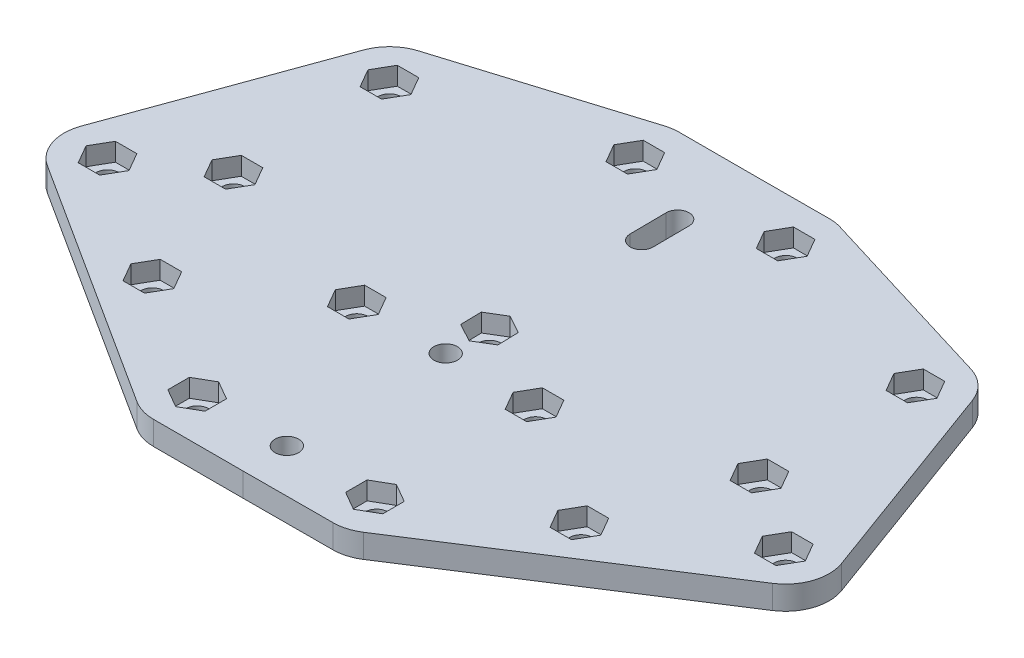
from build123d import *

# Parameters (mm, degrees)
SKETCH2_R          = 3.15
SKETCH2_R_2        = 3.25
SKETCH2_R_3        = 3.1
MAINPLATE_DEPTH    = 6.5
PRESSFITNUTS_DEPTH = 5


with BuildPart() as part:
    # Sketch2 → MainPlate (new body)
    with BuildSketch(Plane(origin=(0, 0, 0), x_dir=(1, 0, 0), z_dir=(0, 1, 0))):
        with BuildLine():
            Line((24.899900609, -92.429929219), (0.2, -92.5))
            Line((0.2, -92.5), (-24.5, -92.5))
            ThreePointArc((-24.5, -92.5), (-27.871368271, -92.016678166), (-30.971160559, -90.605645997))
            Line((-30.971160559, -90.605645997), (-99.683475736, -46.605645997))
            ThreePointArc((-99.683475736, -46.605645997), (-104.578950448, -40.347025165), (-104.490786491, -32.401697323))
            Line((-104.490786491, -32.401697323), (-83.778471314, 24.598302677))
            ThreePointArc((-83.778471314, 24.598302677), (-80.773721892, 29.191692934), (-76.037940173, 31.966602781))
            Line((-76.037940173, 31.966602781), (-24.911380811, 47.741345462))
            ThreePointArc((-24.911380811, 47.741345462), (-22.845839779, 48.308813352), (-20.712315177, 48.5))
            Line((-20.712315177, 48.5), (0, 48.5))
            Line((0, 48.5), (20.712231832, 48.558758223))
            ThreePointArc((20.712231832, 48.558758223), (22.846290221, 48.373624884), (24.913432777, 47.812018957))
            Line((24.913432777, 47.812018957), (76.084537362, 32.182379345))
            ThreePointArc((76.084537362, 32.182379345), (80.828172093, 29.420915478), (83.845940292, 24.836067799))
            Line((83.845940292, 24.836067799), (104.719873926, -32.104944614))
            ThreePointArc((104.719873926, -32.104944614), (104.830577421, -40.049990373), (99.952877324, -46.322473865))
            Line((99.952877324, -46.322473865), (31.365661085, -90.517224974))
            ThreePointArc((31.365661085, -90.517224974), (28.26988419, -91.937045184), (24.899900609, -92.429929219))
        make_face()
        with Locations(Location((-72.5, 20.5, 0), (0, 0, 90))):
            Circle(SKETCH2_R, mode=Mode.SUBTRACT)
        with Locations(Location((-20.712315177, 36.5, 0), (0, 0, 90))):
            Circle(SKETCH2_R, mode=Mode.SUBTRACT)
        with Locations(Location((-93.212315177, -36.5, 0), (0, 0, 90))):
            Circle(SKETCH2_R, mode=Mode.SUBTRACT)
        with Locations(Location((-58.856157589, -58.5, 0), (0, 0, 90))):
            Circle(SKETCH2_R, mode=Mode.SUBTRACT)
        with Locations(Location((-24.5, -80.5, 0), (0, 0, 90))):
            Circle(SKETCH2_R, mode=Mode.SUBTRACT)
        with Locations(Location((-24.5, -36.5, 0), (0, 0, 90))):
            Circle(SKETCH2_R, mode=Mode.SUBTRACT)
        with Locations(Location((-72.5, -22.5, 0), (0, 0, 90))):
            Circle(SKETCH2_R, mode=Mode.SUBTRACT)
        with Locations(Location((24.74103568, -36.430154559, 0), (0, 0, 90))):
            Circle(SKETCH2_R, mode=Mode.SUBTRACT)
        with Locations(Location((24.865858124, -80.429977506, 0), (0, 0, 90))):
            Circle(SKETCH2_R, mode=Mode.SUBTRACT)
        with Locations(Location((59.159466244, -58.332601952, 0), (0, 0, 90))):
            Circle(SKETCH2_R, mode=Mode.SUBTRACT)
        with Locations(Location((93.453074364, -36.235226398, 0), (0, 0, 90))):
            Circle(SKETCH2_R, mode=Mode.SUBTRACT)
        with Locations(Location((72.701126299, -22.294040956, 0), (0, 0, 90))):
            Circle(SKETCH2_R, mode=Mode.SUBTRACT)
        with Locations(Location((72.579140729, 20.705786015, 0), (0, 0, 90))):
            Circle(SKETCH2_R, mode=Mode.SUBTRACT)
        with Locations(Location((20.746274317, 36.55880651, 0), (0, 0, 90))):
            Circle(SKETCH2_R, mode=Mode.SUBTRACT)
        with Locations(Location((0, -36.5, 0), (0, 0, 90))):
            Circle(SKETCH2_R_2, mode=Mode.SUBTRACT)
        with Locations(Location((0.182929062, -80.464988753, 0), (0, 0, 90))):
            Circle(SKETCH2_R_2, mode=Mode.SUBTRACT)
        with Locations(Location((0.103546099, -24.5, 0), (0, 0, 90))):
            Circle(SKETCH2_R_3, mode=Mode.SUBTRACT)
        with BuildLine():
            Line((3.105906565, 27.527701056), (3.193849827, 17.527701056))
            ThreePointArc((3.193849827, 17.527701056), (0.071672688, 14.350121804), (-3.105906565, 17.472298944))
            Line((-3.105906565, 17.472298944), (-3.193849827, 27.472298944))
            ThreePointArc((-3.193849827, 27.472298944), (-0.071672688, 30.649878196), (3.105906565, 27.527701056))
        make_face(mode=Mode.SUBTRACT)
    extrude(amount=MAINPLATE_DEPTH)

    # Sketch8 → PressFitNuts (cut)
    with BuildSketch(Plane(origin=(0, 6.5, 0), x_dir=(1, 0, 0), z_dir=(0, 1, 0))):
        Polygon((-4.835460238, -27.48990798), (0.223379197, -30.272258948), (5.162385534, -27.282350968), (5.042552437, -21.51009202), (-0.016286998, -18.727741052), (-4.955293335, -21.717649032), align=None)
        Polygon((-18.582159741, -36.5), (-21.54107987, -31.375), (-27.45892013, -31.375), (-30.417840259, -36.5), (-27.45892013, -41.625), (-21.54107987, -41.625), align=None)
        Polygon((-66.582159741, -22.5), (-69.54107987, -17.375), (-75.45892013, -17.375), (-78.417840259, -22.5), (-75.45892013, -27.625), (-69.54107987, -27.625), align=None)
        Polygon((-66.582159741, 20.5), (-69.54107987, 25.625), (-75.45892013, 25.625), (-78.417840259, 20.5), (-75.45892013, 15.375), (-69.54107987, 15.375), align=None)
        Polygon((-87.294474918, -36.5), (-90.253395048, -31.375), (-96.171235307, -31.375), (-99.130155436, -36.5), (-96.171235307, -41.625), (-90.253395048, -41.625), align=None)
        Polygon((-52.938317329, -58.5), (-55.897237459, -53.375), (-61.815077718, -53.375), (-64.773997848, -58.5), (-61.815077718, -63.625), (-55.897237459, -63.625), align=None)
        Polygon((-24.5, -74.582159741), (-29.625, -77.54107987), (-29.625, -83.45892013), (-24.5, -86.417840259), (-19.375, -83.45892013), (-19.375, -77.54107987), align=None)
        Polygon((-14.794474918, 36.5), (-17.753395048, 41.625), (-23.671235307, 41.625), (-26.630155436, 36.5), (-23.671235307, 31.375), (-17.753395048, 31.375), align=None)
        Polygon((17.753395048, 31.375), (14.794474918, 36.5), (17.753395048, 41.625), (23.671235307, 41.625), (26.630155436, 36.5), (23.671235307, 31.375), align=None)
        Polygon((19.375, -77.54107987), (24.5, -74.582159741), (29.625, -77.54107987), (29.625, -83.45892013), (24.5, -86.417840259), (19.375, -83.45892013), align=None)
        Polygon((55.897237459, -63.625), (52.938317329, -58.5), (55.897237459, -53.375), (61.815077718, -53.375), (64.773997848, -58.5), (61.815077718, -63.625), align=None)
        Polygon((90.253395048, -41.625), (87.294474918, -36.5), (90.253395048, -31.375), (96.171235307, -31.375), (99.130155436, -36.5), (96.171235307, -41.625), align=None)
        Polygon((69.54107987, 15.375), (66.582159741, 20.5), (69.54107987, 25.625), (75.45892013, 25.625), (78.417840259, 20.5), (75.45892013, 15.375), align=None)
        Polygon((69.54107987, -27.625), (66.582159741, -22.5), (69.54107987, -17.375), (75.45892013, -17.375), (78.417840259, -22.5), (75.45892013, -27.625), align=None)
        Polygon((21.54107987, -41.625), (18.582159741, -36.5), (21.54107987, -31.375), (27.45892013, -31.375), (30.417840259, -36.5), (27.45892013, -41.625), align=None)
    extrude(amount=-PRESSFITNUTS_DEPTH, mode=Mode.SUBTRACT)


solid = part.part
